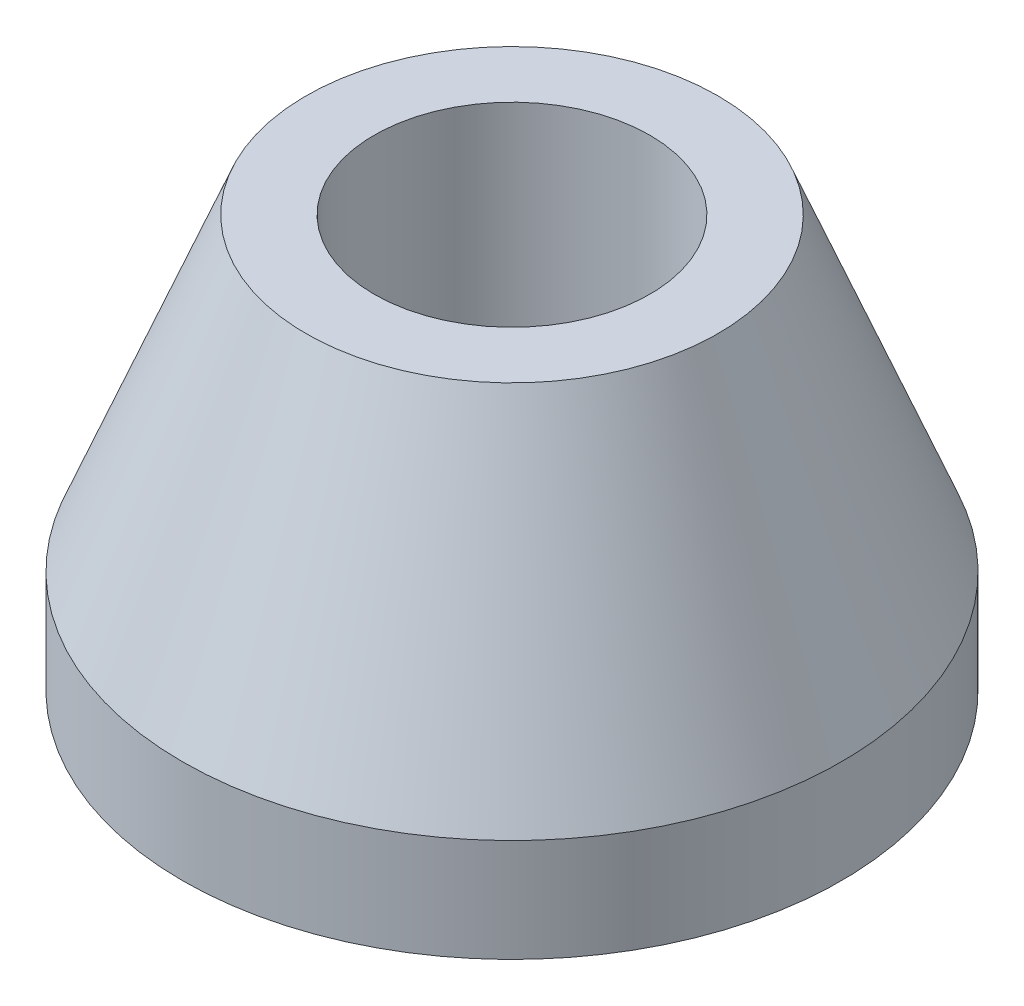
from build123d import *

# Parameters (mm, degrees)
SKETCH6_R          = 4.25
CUT_EXTRUDE3_DEPTH = 20.176579466
CUT_EXTRUDE4_DEPTH = 6.35


with BuildPart() as part:
    # Sketch2 → Revolve1 (revolve)
    with BuildSketch(Plane(origin=(0, 0, 0), x_dir=(0, 0, -1), z_dir=(1, 0, 0)), mode=Mode.PRIVATE) as revolve1_sk:
        Polygon((0, 0), (-6.35, 0), (-10.16, -9.525), (-10.16, -12.7), (0, -12.7), align=None)
    revolve(revolve1_sk.sketch.rotate(Axis((0, -12.7, 0), (0, 1, 0)), 180), axis=Axis((0, -12.7, 0), (0, 1, 0)))

    # Sketch6 → Cut-Extrude3 (cut, through all)
    with BuildSketch(Plane(origin=(0, 0, 0), x_dir=(1, 0, 0), z_dir=(0, 1, 0))):
        with Locations(Location((0, 0, 0), (0, 0, 270))):
            Circle(SKETCH6_R)
    extrude(amount=-CUT_EXTRUDE3_DEPTH, mode=Mode.SUBTRACT)

    # Sketch7 → Cut-Extrude4 (cut)
    with BuildSketch(Plane.XZ.offset(12.7)):
        Polygon((0, 7.274613392), (-6.3, 3.637306696), (-6.3, -3.637306696), (0, -7.274613392), (6.3, -3.637306696), (6.3, 3.637306696), align=None)
    extrude(amount=-CUT_EXTRUDE4_DEPTH, mode=Mode.SUBTRACT)


solid = part.part
